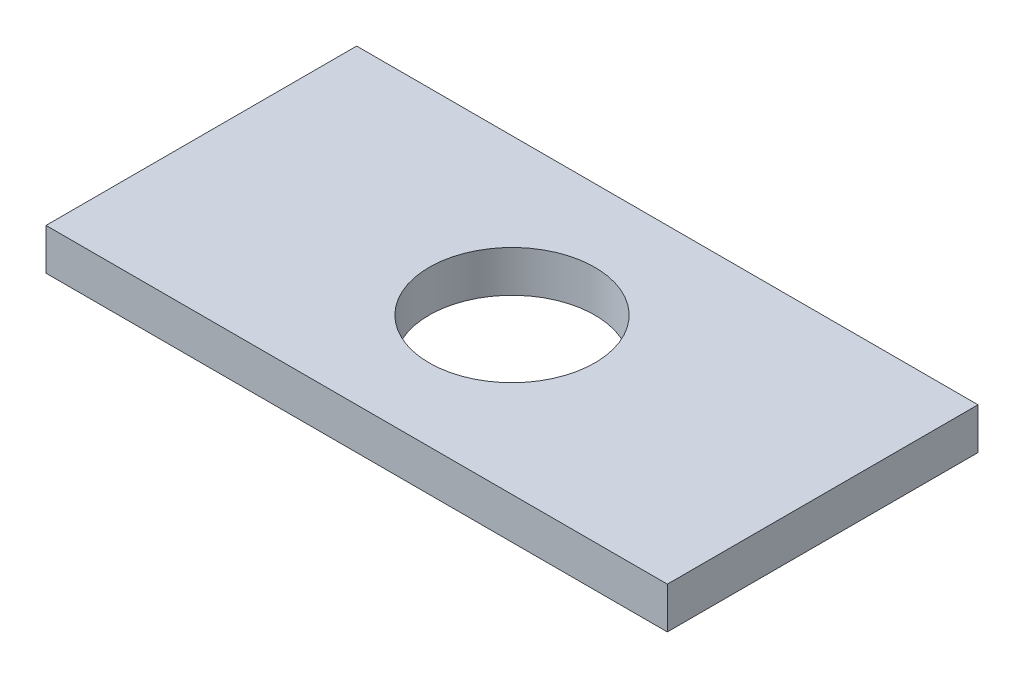
from build123d import *

# Parameters (mm, degrees)
SKETCH1_W           = 30
SKETCH1_H           = 15
SKETCH1_R           = 4
BOSS_EXTRUDE2_DEPTH = 2


with BuildPart() as part:
    # Sketch1 → Boss-Extrude2 (new body)
    with BuildSketch(Plane(origin=(0, 0, 0), x_dir=(1, 0, 0), z_dir=(0, 1, 0))):
        with Locations((15, 7.5)):
            Rectangle(SKETCH1_W, SKETCH1_H)
        with Locations(Location((15, 7.5, 0), (0, 0, 270))):
            Circle(SKETCH1_R, mode=Mode.SUBTRACT)
    extrude(amount=BOSS_EXTRUDE2_DEPTH)


solid = part.part
